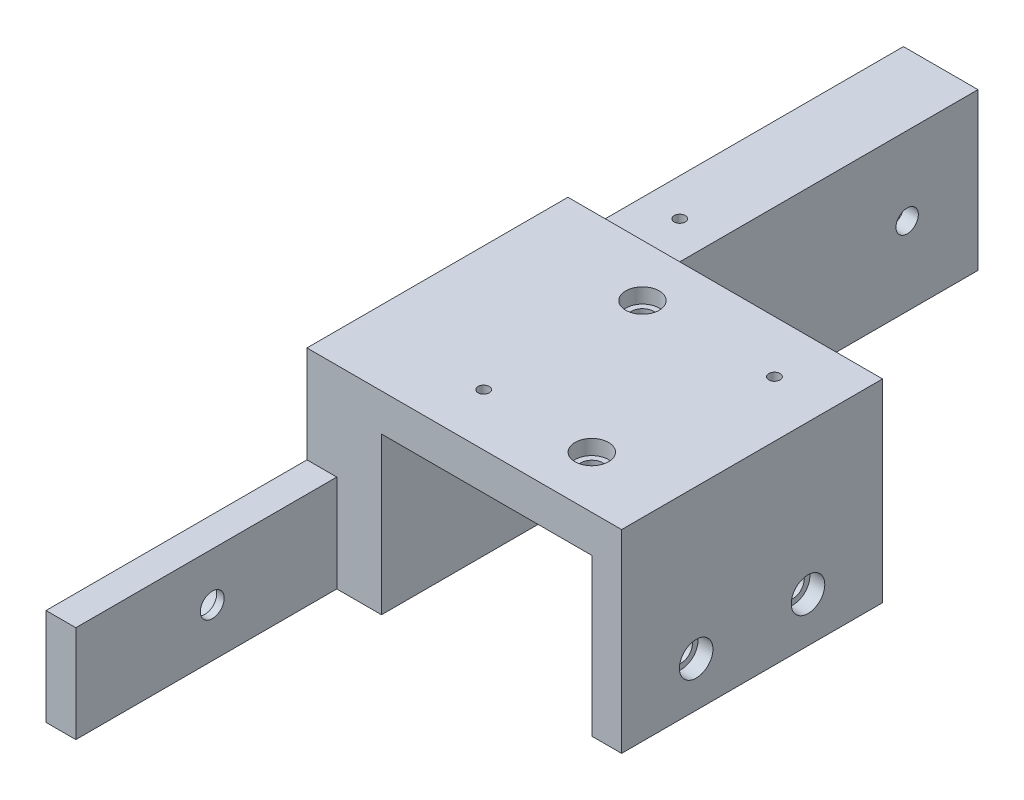
from build123d import *

# Parameters (mm, degrees)
SKETCH_1_W           = 42.2
SKETCH_1_H           = 35
EXTRUDE_1_DEPTH      = 5
SKETCH_1_14_W        = 4
SKETCH_1_14_H        = 35
SKETCH_1_14_W_2      = 10
SKETCH_1_14_H_2      = 80
EXTRUDE_2_DEPTH      = 21
EXTRUDE_START        = -10
SKETCH_2_W           = 35
SKETCH_2_H           = 13
EXTRUDE_3_DEPTH      = 4
CUT_EXTRUDE_START    = -10
SKETCH_2_3_R         = 3.1
CUT_EXTRUDE_1_DEPTH  = 3
SKETCH_3_R           = 1.5
CUT_EXTRUDE_2_DEPTH  = 86.772023411
SKETCH_3_4_R         = 2.25
CUT_EXTRUDE_3_DEPTH  = 2
SKETCH_4_R           = 0.75
CUT_EXTRUDE_4_DEPTH  = 4
CUT_EXTRUDE_START_2  = -17
SKETCH_4_3_R         = 0.75
CUT_EXTRUDE_5_DEPTH  = 4
SKETCH_5_R           = 1.5
CUT_EXTRUDE_6_DEPTH  = 85.39099478
SKETCH_5_3_R         = 2.25
CUT_EXTRUDE_7_DEPTH  = 8
CUT_EXTRUDE_8_REACH  = 86.391
SKETCH_6_R           = 1.5
SKETCH_6_3_R         = 2.25
CUT_EXTRUDE_9_DEPTH  = 2
SKETCH_7_R           = 0.75
CUT_EXTRUDE_10_DEPTH = 4
SKETCH_2_4_R         = 1.6
CUT_EXTRUDE_11_DEPTH = 80.861379903


with BuildPart() as part:
    # 草图1 → 凸台-拉伸1 (new body)
    with BuildSketch(Plane(origin=(0, 0, 0), x_dir=(1, 0, 0), z_dir=(0, 1, 0))):
        with Locations((21.1, -17.5)):
            Rectangle(SKETCH_1_W, SKETCH_1_H)
    extrude(amount=EXTRUDE_1_DEPTH)

    # 草图1<14> → 凸台-拉伸2 (add)
    with BuildSketch(Plane(origin=(0, 0, 0), x_dir=(1, 0, 0), z_dir=(0, 1, 0))):
        with Locations((40.2, -17.5)):
            Rectangle(SKETCH_1_14_W, SKETCH_1_14_H)
        with Locations((5, 5)):
            Rectangle(SKETCH_1_14_W_2, SKETCH_1_14_H_2)
    extrude(amount=-EXTRUDE_2_DEPTH)

    # 草图2 → 凸台-拉伸3 (add)
    with BuildSketch(Plane(origin=(10, 0, 0), x_dir=(0, 0, -1), z_dir=(1, 0, 0)).offset(EXTRUDE_START)):
        with Locations((-52.5, -14.5)):
            Rectangle(SKETCH_2_W, SKETCH_2_H)
    extrude(amount=EXTRUDE_3_DEPTH)

    # 草图2<3> → 切除-拉伸1 (cut)
    with BuildSketch(Plane(origin=(10, 0, 0), x_dir=(0, 0, -1), z_dir=(1, 0, 0)).offset(CUT_EXTRUDE_START)):
        with Locations((-29.4, -14.5)):
            Circle(SKETCH_2_3_R)
        with Locations((-51.7, -14.5)):
            Circle(SKETCH_2_3_R)
        with Locations((-8.399047641, -7.1)):
            Circle(SKETCH_2_3_R)
    extrude(amount=CUT_EXTRUDE_1_DEPTH, mode=Mode.SUBTRACT)

    # 草图3 → 切除-拉伸2 (cut, through all)
    with BuildSketch(Plane(origin=(0, 5, 0), x_dir=(1, 0, 0), z_dir=(0, 1, 0))):
        with Locations(Location((17, -7, 0), (0, 0, 270))):
            Circle(SKETCH_3_R)
        with Locations(Location((31.2, -28, 0), (0, 0, 270))):
            Circle(SKETCH_3_R)
    extrude(amount=-CUT_EXTRUDE_2_DEPTH, mode=Mode.SUBTRACT)

    # 草图3<4> → 切除-拉伸3 (cut)
    with BuildSketch(Plane(origin=(0, 5, 0), x_dir=(1, 0, 0), z_dir=(0, 1, 0))):
        with Locations(Location((17, -7, 0), (0, 0, 270))):
            Circle(SKETCH_3_4_R)
        with Locations(Location((31.2, -28, 0), (0, 0, 270))):
            Circle(SKETCH_3_4_R)
    extrude(amount=-CUT_EXTRUDE_3_DEPTH, mode=Mode.SUBTRACT)

    # 草图4 → 切除-拉伸4 (cut)
    with BuildSketch(Plane.XZ.offset(21)):
        with Locations(Location((4.998492594, -10.000952359, 0), (0, 0, 270))):
            Circle(SKETCH_4_R)
        with Locations(Location((4.998492594, -35.000952359, 0), (0, 0, 270))):
            Circle(SKETCH_4_R)
    extrude(amount=-CUT_EXTRUDE_4_DEPTH, mode=Mode.SUBTRACT)

    # 草图4<3> → 切除-拉伸5 (cut)
    with BuildSketch(Plane.XZ.offset(21).offset(CUT_EXTRUDE_START_2)):
        with Locations(Location((4.998492594, -10.000952359, 0), (0, 0, 270))):
            Circle(SKETCH_4_3_R)
    extrude(amount=-CUT_EXTRUDE_5_DEPTH, mode=Mode.SUBTRACT)

    # 草图5 → 切除-拉伸6 (cut, through all)
    with BuildSketch(Plane.ZY):
        with Locations((-35.5, -10.5)):
            Circle(SKETCH_5_R)
    extrude(amount=-CUT_EXTRUDE_6_DEPTH, mode=Mode.SUBTRACT)

    # 草图5<3> → 切除-拉伸7 (cut)
    with BuildSketch(Plane.ZY):
        with Locations((-35.5, -10.5)):
            Circle(SKETCH_5_3_R)
    extrude(amount=-CUT_EXTRUDE_7_DEPTH, mode=Mode.SUBTRACT)

    # 草图6 → 切除-拉伸8 (cut, up to next)
    with BuildSketch(Plane(origin=(42.2, 0, 0), x_dir=(0, 0, -1), z_dir=(1, 0, 0)), mode=Mode.PRIVATE) as cut_extrude_8_sk1:
        with Locations((-25, -15)):
            Circle(SKETCH_6_R)
    cut_extrude_8_tool1 = extrude(cut_extrude_8_sk1.sketch, amount=-CUT_EXTRUDE_8_REACH, mode=Mode.PRIVATE) & part.part
    # 草图6 → 切除-拉伸8 (cut, up to next)
    with BuildSketch(Plane(origin=(42.2, 0, 0), x_dir=(0, 0, -1), z_dir=(1, 0, 0)), mode=Mode.PRIVATE) as cut_extrude_8_sk2:
        with Locations((-10, -15)):
            Circle(SKETCH_6_R)
    cut_extrude_8_tool2 = extrude(cut_extrude_8_sk2.sketch, amount=-CUT_EXTRUDE_8_REACH, mode=Mode.PRIVATE) & part.part
    add(cut_extrude_8_tool1.solids().sort_by_distance((42.2, -15, 25))[0], mode=Mode.SUBTRACT)
    add(cut_extrude_8_tool2.solids().sort_by_distance((42.2, -15, 10))[0], mode=Mode.SUBTRACT)

    # 草图6<3> → 切除-拉伸9 (cut)
    with BuildSketch(Plane(origin=(42.2, 0, 0), x_dir=(0, 0, -1), z_dir=(1, 0, 0))):
        with Locations((-25, -15)):
            Circle(SKETCH_6_3_R)
        with Locations((-10, -15)):
            Circle(SKETCH_6_3_R)
    extrude(amount=-CUT_EXTRUDE_9_DEPTH, mode=Mode.SUBTRACT)

    # 草图7 → 切除-拉伸10 (cut)
    with BuildSketch(Plane(origin=(0, 5, 0), x_dir=(1, 0, 0), z_dir=(0, 1, 0))):
        with Locations(Location((16.698492594, -27.999047641, 0), (0, 0, 270))):
            Circle(SKETCH_7_R)
        with Locations(Location((34.698492594, -6.999047641, 0), (0, 0, 270))):
            Circle(SKETCH_7_R)
    extrude(amount=-CUT_EXTRUDE_10_DEPTH, mode=Mode.SUBTRACT)

    # 草图2<4> → 切除-拉伸11 (cut, through all)
    with BuildSketch(Plane(origin=(10, 0, 0), x_dir=(0, 0, -1), z_dir=(1, 0, 0))):
        with Locations((-51.7, -14.5)):
            Circle(SKETCH_2_4_R)
    extrude(amount=-CUT_EXTRUDE_11_DEPTH, mode=Mode.SUBTRACT)


solid = part.part
